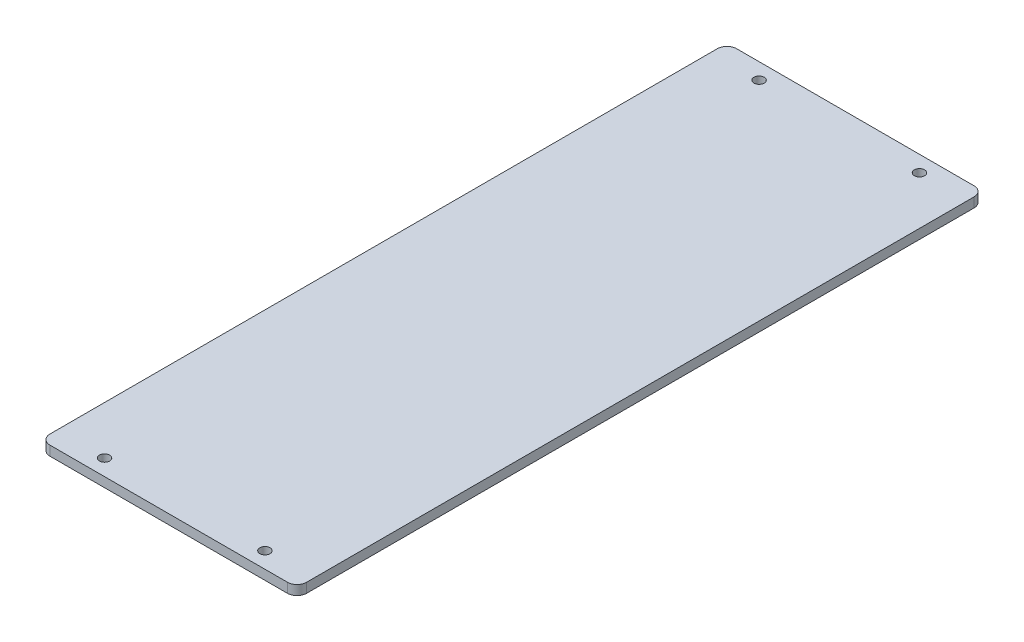
from build123d import *

# Parameters (mm, degrees)
SPINE_BODY_DEPTH = 1.5
SKETCH2_R        = 1.6
TAB_HOLES_DEPTH  = 115.271606272


with BuildPart() as part:
    # Sketch1 → Spine_Body (new, symmetric)
    with BuildSketch(Plane(origin=(0, 0, 0), x_dir=(1, 0, 0), z_dir=(0, 1, 0))):
        with BuildLine():
            Line((-37, 107), (37, 107))
            ThreePointArc((37, 107), (39.121320344, 106.121320344), (40, 104))
            Line((40, 104), (40, -104))
            ThreePointArc((40, -104), (39.121320344, -106.121320344), (37, -107))
            Line((37, -107), (-37, -107))
            ThreePointArc((-37, -107), (-39.121320344, -106.121320344), (-40, -104))
            Line((-40, -104), (-40, 104))
            ThreePointArc((-40, 104), (-39.121320344, 106.121320344), (-37, 107))
        make_face()
    extrude(amount=SPINE_BODY_DEPTH, both=True)

    # Sketch2 → Tab_Holes (cut, through all)
    with BuildSketch(Plane(origin=(0, 1.5, 0), x_dir=(1, 0, 0), z_dir=(0, 1, 0))):
        with Locations(Location((-25, -102, 0), (0, 0, 270))):
            Circle(SKETCH2_R)
        with Locations(Location((25, -102, 0), (0, 0, 270))):
            Circle(SKETCH2_R)
        with Locations(Location((25, 102, 0), (0, 0, 90))):
            Circle(SKETCH2_R)
        with Locations(Location((-25, 102, 0), (0, 0, 90))):
            Circle(SKETCH2_R)
    extrude(amount=-TAB_HOLES_DEPTH, mode=Mode.SUBTRACT)


solid = part.part
